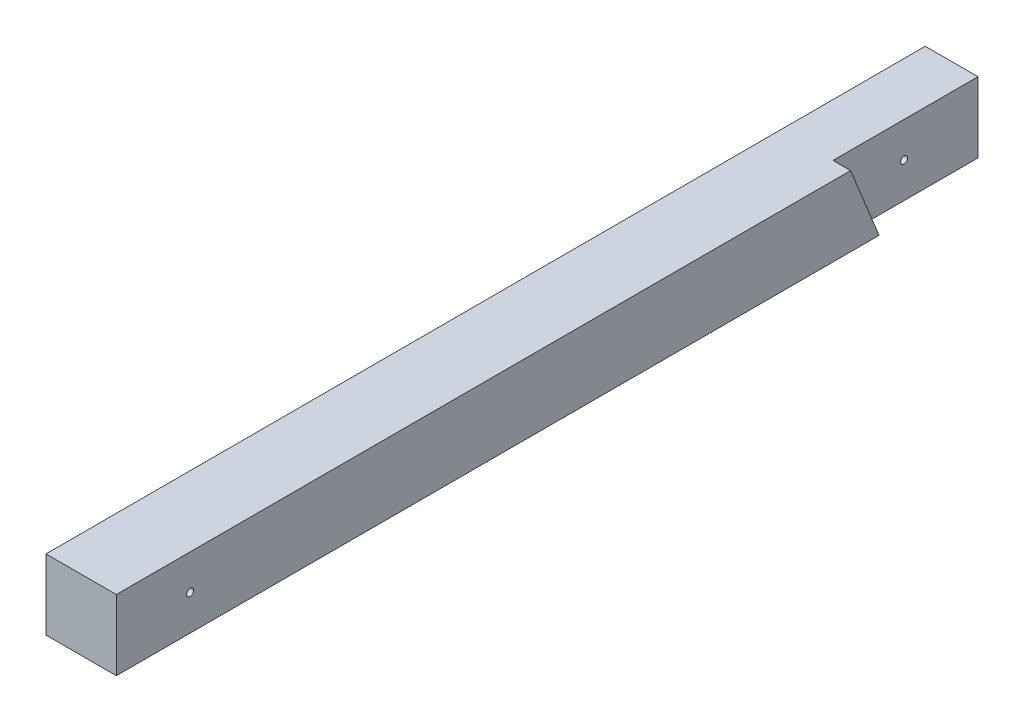
from build123d import *

# Parameters (mm, degrees)
SKETCH1_W           = 100
SKETCH1_H           = 100
BOSS_EXTRUDE1_DEPTH = 625
SKETCH2_R           = 5
CUT_EXTRUDE1_DEPTH  = 635.92125496
CUT_EXTRUDE2_DEPTH  = 25


with BuildPart() as part:
    # Sketch1 → Boss-Extrude1 (new, symmetric)
    with BuildSketch(Plane.XY):
        Rectangle(SKETCH1_W, SKETCH1_H)
    extrude(amount=BOSS_EXTRUDE1_DEPTH, both=True)

    # Sketch2 → Cut-Extrude1 (cut, through all)
    with BuildSketch(Plane.ZY.offset(50)):
        with Locations(Location((-520, 0, 0), (0, 0, 270))):
            Circle(SKETCH2_R)
        with Locations(Location((520, 0, 0), (0, 0, 270))):
            Circle(SKETCH2_R)
    extrude(amount=-CUT_EXTRUDE1_DEPTH, mode=Mode.SUBTRACT)

    # Sketch3 → Cut-Extrude2 (cut)
    with BuildSketch(Plane(origin=(50, 0, 0), x_dir=(0, 0, -1), z_dir=(1, 0, 0))):
        Polygon((418.892046252, 50), (459.315842164, -50), (625, -50), (625, 50), align=None)
    extrude(amount=-CUT_EXTRUDE2_DEPTH, mode=Mode.SUBTRACT)


solid = part.part
